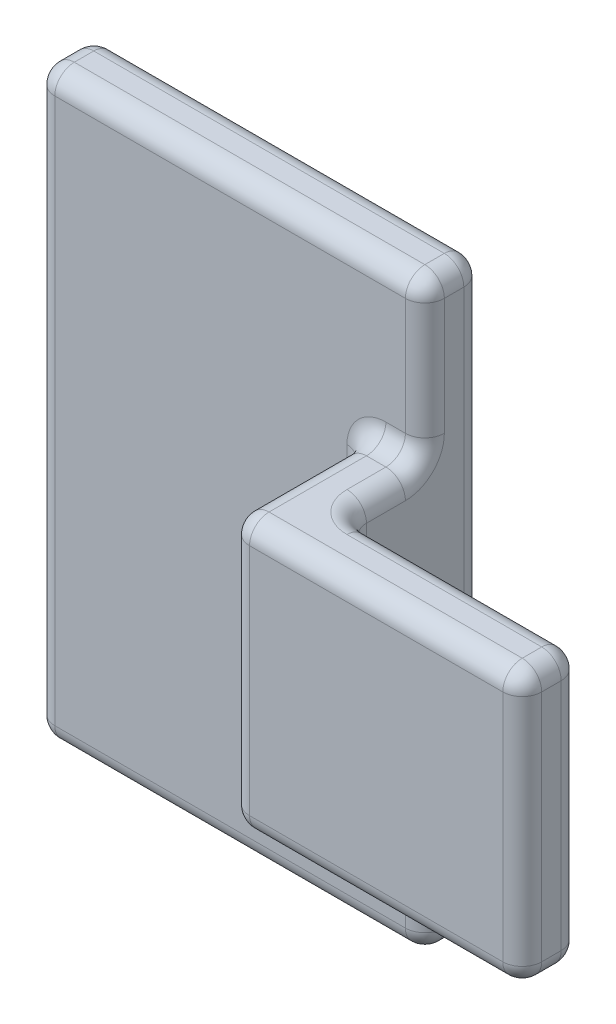
from build123d import *

# Parameters (mm, degrees)
SKETCH1_W           = 20
SKETCH1_H           = 30
BOSS_EXTRUDE1_DEPTH = 3
SKETCH3_W           = 7
SKETCH3_H           = 14
BOSS_EXTRUDE2_DEPTH = 3
SKETCH4_W           = 3
SKETCH4_H           = 14
BOSS_EXTRUDE3_DEPTH = 15
FILLET1_R           = 1
FILLET2_R           = 1


with BuildPart() as part:
    # Sketch1 → Boss-Extrude1 (new body)
    with BuildSketch(Plane.XY):
        with Locations((10, -15)):
            Rectangle(SKETCH1_W, SKETCH1_H)
    extrude(amount=BOSS_EXTRUDE1_DEPTH)

    # Sketch3 → Boss-Extrude2 (add)
    with BuildSketch(Plane.ZY.offset(-20)):
        with Locations((6.5, -15)):
            Rectangle(SKETCH3_W, SKETCH3_H)
    extrude(amount=BOSS_EXTRUDE2_DEPTH)

    # Sketch4 → Boss-Extrude3 (add)
    with BuildSketch(Plane.ZY.offset(-17)):
        with Locations((8.5, -15)):
            Rectangle(SKETCH4_W, SKETCH4_H)
    extrude(amount=-BOSS_EXTRUDE3_DEPTH)

    # Fillet1
    fillet1_edges = [part.edges().sort_by_distance(p)[0] for p in [
        (20, -4, 3),
        (18.5, -8, 3),
        (20, -22, 5),
        (18.5, -22, 3),
        (24.5, -22, 10),
        (24.5, -8, 10),
        (17, -15, 3),
        (17, -22, 6.5),
        (17, -15, 10),
        (17, -8, 6.5),
        (20, -8, 5),
        (32, -15, 10),
        (32, -22, 8.5),
        (32, -15, 7),
        (26, -22, 7),
        (32, -8, 8.5),
        (26, -8, 7),
        (20, -15, 7),
        (20, -26, 3),
    ]]
    fillet(fillet1_edges, radius=FILLET1_R)

    # Fillet2
    fillet2_edges = [part.edges().sort_by_distance(p)[0] for p in [
        (0, -15, 3),
        (9.5, 0, 3),
        (9.5, -30, 3),
        (0, -15, 0),
        (20, -30, 1),
        (20, 0, 1),
        (10, 0, 0),
        (19.707106781, -30, 2.707106781),
        (19.707106781, 0, 2.707106781),
        (20, -15, 0),
        (10, -30, 0),
        (0, -30, 1.5),
        (0, 0, 1.5),
    ]]
    fillet(fillet2_edges, radius=FILLET2_R)


solid = part.part
